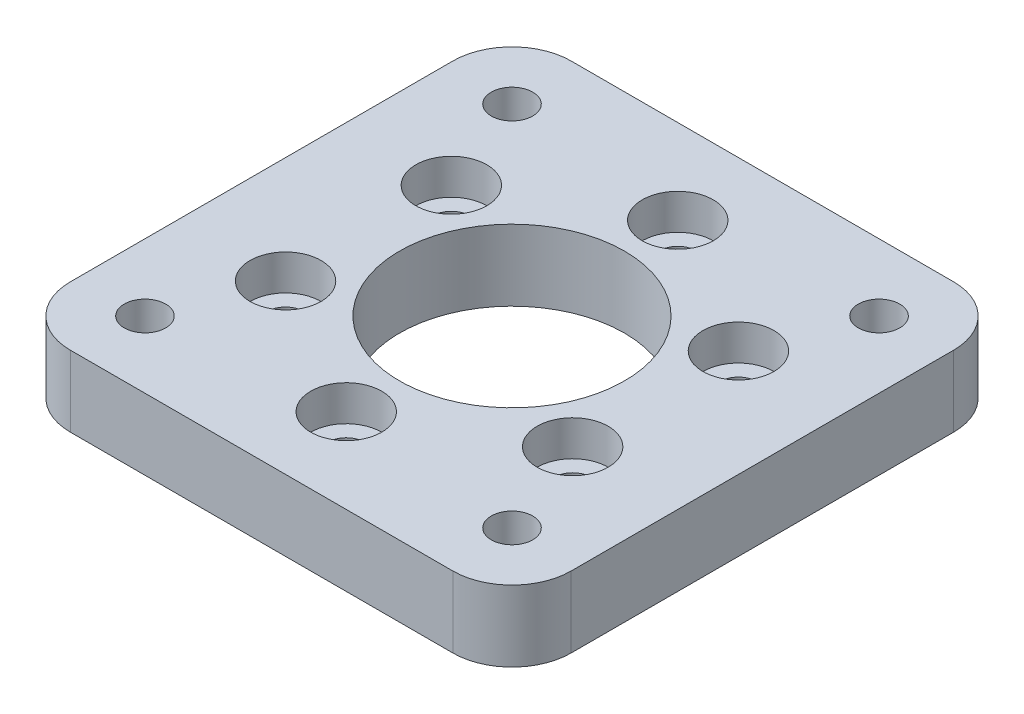
from build123d import *

# Parameters (mm, degrees)
SKETCH1_W           = 42.3
SKETCH1_H           = 42.3
BOSS_EXTRUDE1_DEPTH = 3
FILLET1_R           = 5
SKETCH2_R           = 1.75
CUT_EXTRUDE1_DEPTH  = 31.506474723
SKETCH4_R           = 9.5
CUT_EXTRUDE3_DEPTH  = 31.506474723
SKETCH5_R           = 1.55
CUT_EXTRUDE4_DEPTH  = 31.506474723
SKETCH6_R           = 3
CUT_EXTRUDE5_DEPTH  = 3
CIRPATTERN1_COUNT   = 6


with BuildPart() as part:
    # Sketch1 → Boss-Extrude1 (new, symmetric)
    with BuildSketch(Plane(origin=(0, 0, 0), x_dir=(1, 0, 0), z_dir=(0, 1, 0))):
        Rectangle(SKETCH1_W, SKETCH1_H)
    extrude(amount=BOSS_EXTRUDE1_DEPTH, both=True)

    # Fillet1
    fillet1_edges = [part.edges().sort_by_distance(p)[0] for p in [
        (21.15, 0, 21.15),
        (-21.15, 0, 21.15),
        (-21.15, 0, -21.15),
        (21.15, 0, -21.15),
    ]]
    fillet(fillet1_edges, radius=FILLET1_R)

    # Sketch2 → Cut-Extrude1 (cut, through all)
    with BuildSketch(Plane.XZ.offset(3)):
        with Locations(Location((-15.5, 15.5, 0), (0, 0, 270))):
            Circle(SKETCH2_R)
        with Locations(Location((15.5, 15.5, 0), (0, 0, 270))):
            Circle(SKETCH2_R)
        with Locations(Location((15.5, -15.5, 0), (0, 0, 270))):
            Circle(SKETCH2_R)
        with Locations(Location((-15.5, -15.5, 0), (0, 0, 270))):
            Circle(SKETCH2_R)
    extrude(amount=-CUT_EXTRUDE1_DEPTH, mode=Mode.SUBTRACT)

    # Sketch4 → Cut-Extrude3 (cut, through all)
    with BuildSketch(Plane.XZ.offset(3)):
        with Locations(Location((0, 0, 0), (0, 0, 270))):
            Circle(SKETCH4_R)
    extrude(amount=-CUT_EXTRUDE3_DEPTH, mode=Mode.SUBTRACT)

    # Sketch5 → Cut-Extrude4 (cut, through all)
    with BuildSketch(Plane(origin=(0, 3, 0), x_dir=(1, 0, 0), z_dir=(0, 1, 0))):
        with Locations(Location((0, 14, 0), (0, 0, 270))):
            Circle(SKETCH5_R)
    cut_extrude4 = extrude(amount=-CUT_EXTRUDE4_DEPTH, mode=Mode.SUBTRACT)

    # Sketch6 → Cut-Extrude5 (cut)
    with BuildSketch(Plane(origin=(0, 3, 0), x_dir=(1, 0, 0), z_dir=(0, 1, 0))):
        with Locations(Location((0, 14, 0), (0, 0, 270))):
            Circle(SKETCH6_R)
    cut_extrude5 = extrude(amount=-CUT_EXTRUDE5_DEPTH, mode=Mode.SUBTRACT)

    # CirPattern1: Cut-Extrude4, Cut-Extrude5 ×6 about axis
    cirpattern1_axis = Axis((0, 0, 0), (0, 1, 0))
    add([cut_extrude4.rotate(cirpattern1_axis, i * 360 / CIRPATTERN1_COUNT) for i in range(1, CIRPATTERN1_COUNT)], mode=Mode.SUBTRACT)
    add([cut_extrude5.rotate(cirpattern1_axis, i * 360 / CIRPATTERN1_COUNT) for i in range(1, CIRPATTERN1_COUNT)], mode=Mode.SUBTRACT)


solid = part.part
